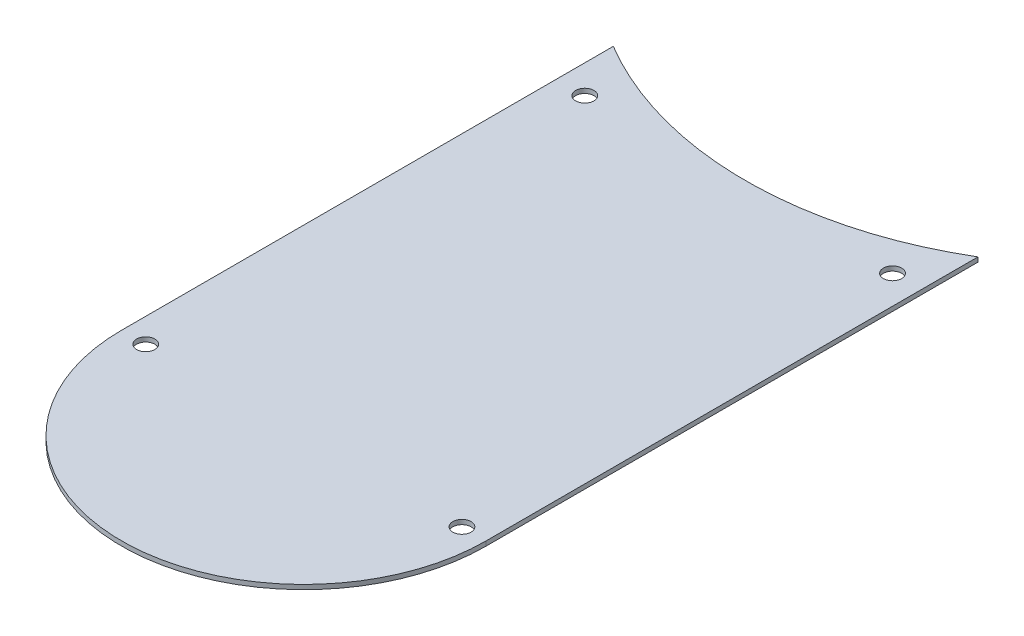
from build123d import *

# Parameters (mm, degrees)
BOSS_EXTRUDE1_DEPTH = 0.8
SKETCH2_R           = 1.6
CUT_EXTRUDE1_DEPTH  = 78.000105196


with BuildPart() as part:
    # Sketch1 → Boss-Extrude1 (new body)
    with BuildSketch(Plane(origin=(0, 0, 0), x_dir=(1, 0, 0), z_dir=(0, 1, 0))):
        with BuildLine():
            Line((-32, -38.031251597), (-32, 48.282157899))
            ThreePointArc((-32, 48.282157899), (0, 39.468748403), (32, 48.282157899))
            Line((32, 48.282157899), (32, -38.031251597))
            ThreePointArc((32, -38.031251597), (0, -70.031251597), (-32, -38.031251597))
        make_face()
    extrude(amount=BOSS_EXTRUDE1_DEPTH)

    # Sketch2 → Cut-Extrude1 (cut, through all)
    with BuildSketch(Plane.XZ):
        with Locations(Location((27.75, 38.031251597, 0), (0, 0, 270))):
            Circle(SKETCH2_R)
        with Locations(Location((-27.75, 38.031251597, 0), (0, 0, 270))):
            Circle(SKETCH2_R)
        with Locations(Location((27, -38.282157899, 0), (0, 0, 270))):
            Circle(SKETCH2_R)
        with Locations(Location((-27, -38.282157899, 0), (0, 0, 270))):
            Circle(SKETCH2_R)
    extrude(amount=-CUT_EXTRUDE1_DEPTH, mode=Mode.SUBTRACT)


solid = part.part
